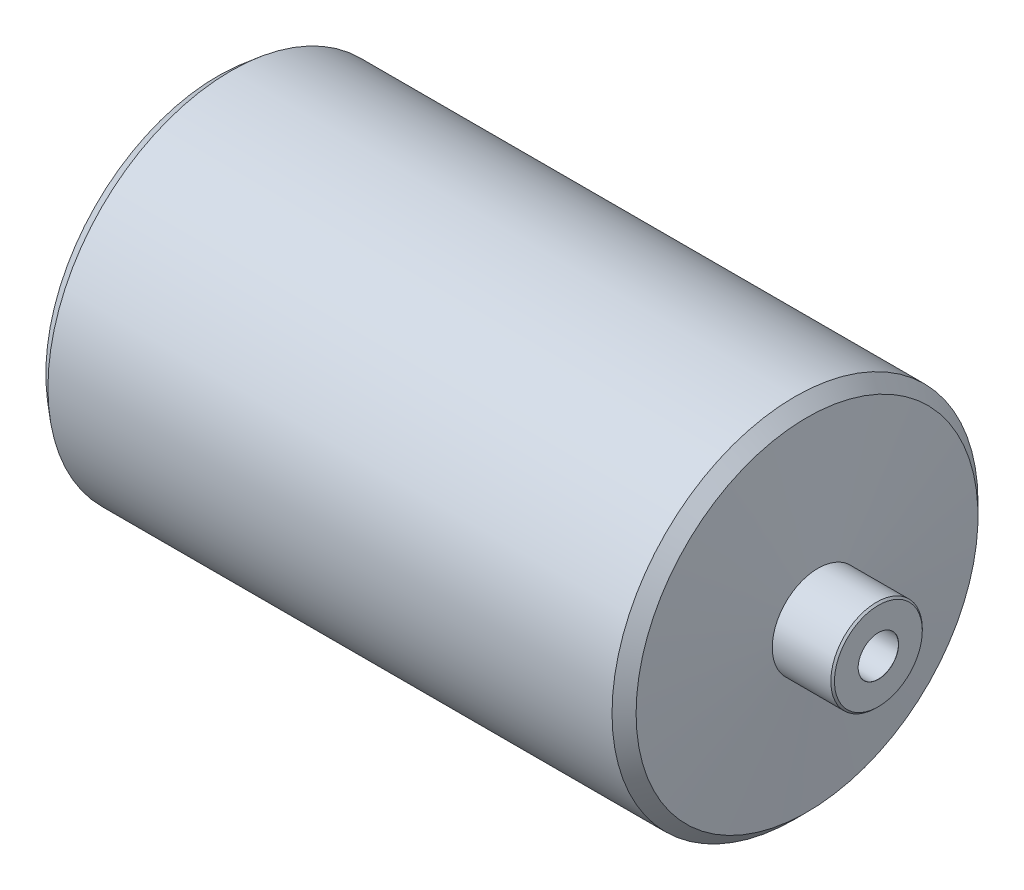
from build123d import *
from OCP.BRepFilletAPI import BRepFilletAPI_MakeChamfer

# Parameters (mm, degrees)
CHAMFER1_SIZE  = 3
CHAMFER1_SIZE2 = 3.300188603
CHAMFER2_SIZE  = 0.5


with BuildPart() as part:
    # Sketch1 → Revolve1 (revolve)
    with BuildSketch(Plane(origin=(0, 0, 0), x_dir=(1, 0, 0), z_dir=(0, 1, 0))):
        Polygon((0, 0), (0, 12.5), (16.5, 12.5), (19.780824882, 50), (180.219175118, 50), (183.5, 12.5), (200, 12.5), (200, 0), align=None)
    revolve(axis=Axis((200, 0, 0), (-1, 0, 0)))

    # Chamfer1: one chamfer whose edges measure the first distance from different faces: ONE call of the kernel's chamfer builder (chamfer() names one face for all edges)
    chamfer1_edges_1 = [part.edges().sort_by_distance(p)[0] for p in [
        (180.219175118, 0, 50),
    ]]
    chamfer1_side_1 = [part.faces().sort_by_distance(p)[0] for p in [
        (100, 0, 50),
    ]]
    chamfer1_edges_2 = [part.edges().sort_by_distance(p)[0] for p in [
        (19.780824882, 0, 50),
    ]]
    chamfer1_side_2 = [part.faces().sort_by_distance(p)[0] for p in [
        (18.140412441, 0, 31.25),
    ]]
    chamfer1 = BRepFilletAPI_MakeChamfer(part.part.solid().wrapped)
    for e in chamfer1_edges_1:
        chamfer1.Add(CHAMFER1_SIZE, CHAMFER1_SIZE2, e.wrapped, chamfer1_side_1[0].wrapped)  # the first distance lies on this face
    for e in chamfer1_edges_2:
        chamfer1.Add(CHAMFER1_SIZE, CHAMFER1_SIZE2, e.wrapped, chamfer1_side_2[0].wrapped)  # the first distance lies on this face
    add(Compound.cast(chamfer1.Shape()), mode=Mode.REPLACE)

    # Chamfer2
    chamfer2_edges = [part.edges().sort_by_distance(p)[0] for p in [
        (200, 0, 12.5),
        (0, 0, 12.5),
    ]]
    chamfer(chamfer2_edges, length=CHAMFER2_SIZE)

    # Sketch3 → M10 Clearance Hole1 (revolve, cut)
    with BuildSketch(Plane(origin=(200, 0, 0), x_dir=(0, 0, -1), z_dir=(0, 1, 0))):
        Polygon((0, 0), (0, 59), (5.5, 55.695266595), (5.5, 0.025), (5.525, 0), align=None)
    m10_clearance_hole1 = revolve(axis=Axis((206.35, 0, 0), (-1, 0, 0)), mode=Mode.SUBTRACT)

    # Mirror1: M10 Clearance Hole1 across plane
    add(m10_clearance_hole1.mirror(Plane(origin=(100, 0, 0), x_dir=(0, 0, 1), z_dir=(1, 0, 0))), mode=Mode.SUBTRACT)


solid = part.part
